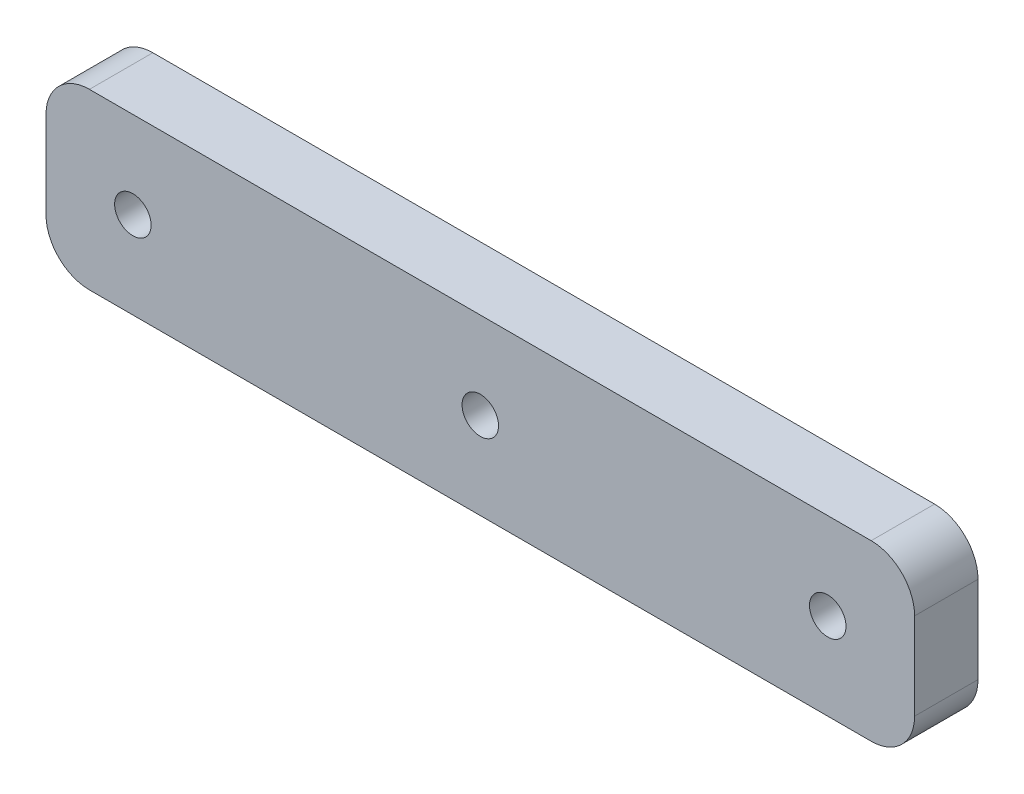
from build123d import *

# Parameters (mm, degrees)
SKETCH_1_W          = 100
SKETCH_1_H          = 20
EXTRUDE_1_DEPTH     = 7.3
SKETCH_2_R          = 2.1
CUT_EXTRUDE_1_DEPTH = 103.241332151
FILLET_1_R          = 5


with BuildPart() as part:
    # 草图1 → 凸台-拉伸1 (new body)
    with BuildSketch(Plane.XY):
        with Locations((50, 10)):
            Rectangle(SKETCH_1_W, SKETCH_1_H)
    extrude(amount=EXTRUDE_1_DEPTH)

    # 草图2 → 切除-拉伸1 (cut, through all)
    with BuildSketch(Plane.XY.offset(7.3)):
        with Locations((10, 10)):
            Circle(SKETCH_2_R)
        with Locations((50, 10)):
            Circle(SKETCH_2_R)
        with Locations((90, 10)):
            Circle(SKETCH_2_R)
    extrude(amount=-CUT_EXTRUDE_1_DEPTH, mode=Mode.SUBTRACT)

    # 圆角1
    fillet_1_edges = [part.edges().sort_by_distance(p)[0] for p in [
        (0, 20, 3.65),
        (100, 20, 3.65),
        (100, 0, 3.65),
        (0, 0, 3.65),
    ]]
    fillet(fillet_1_edges, radius=FILLET_1_R)


solid = part.part
